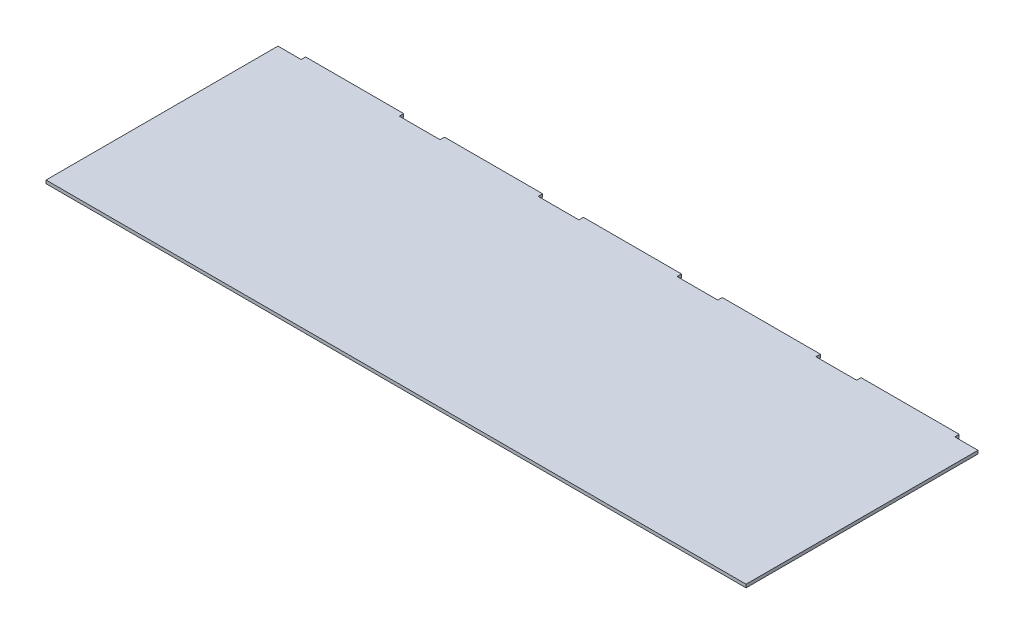
from build123d import *

# Parameters (mm, degrees)
SKETCH1_W           = 498.348
SKETCH1_H           = 165.1
BOSS_EXTRUDE1_DEPTH = 1.143
SKETCH2_W           = 69.85
SKETCH2_H           = 2.286
BOSS_EXTRUDE2_DEPTH = 3.175
LPATTERN1_COUNT     = 5
LPATTERN1_PITCH     = 98.8568


with BuildPart() as part:
    # Sketch1 → Boss-Extrude1 (new, symmetric)
    with BuildSketch(Plane(origin=(0, 0, 0), x_dir=(1, 0, 0), z_dir=(0, 1, 0))):
        Rectangle(SKETCH1_W, SKETCH1_H)
    extrude(amount=BOSS_EXTRUDE1_DEPTH, both=True)

    # Sketch2 → Boss-Extrude2 (add)
    with BuildSketch(Plane(origin=(0, 0, -82.55), x_dir=(-1, 0, 0), z_dir=(0, 0, -1))):
        with Locations((-197.7136, 0)):
            Rectangle(SKETCH2_W, SKETCH2_H)
    boss_extrude2 = extrude(amount=BOSS_EXTRUDE2_DEPTH)

    # LPattern1: Boss-Extrude2 ×5
    with Locations(*[(-i * LPATTERN1_PITCH, 0, 0) for i in range(1, LPATTERN1_COUNT)]):
        add(boss_extrude2)


solid = part.part
